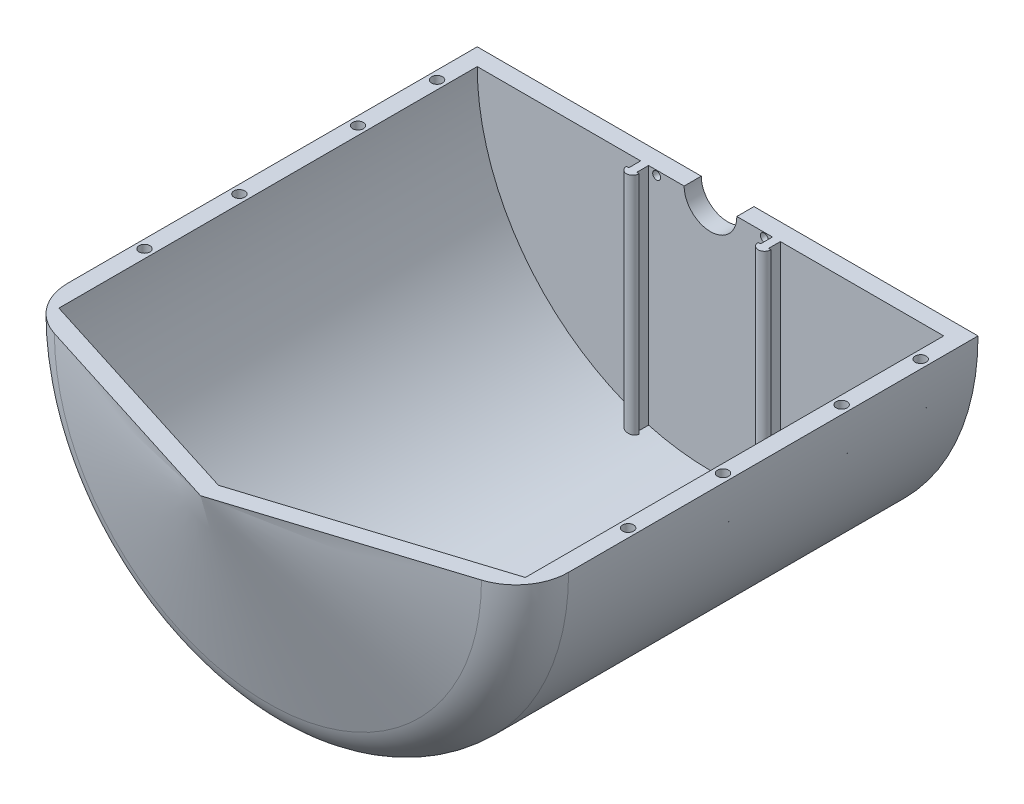
from build123d import *

# Parameters (mm, degrees)
REVOLVE1_ANGLE           = 180
BOSS_EXTRUDE8_REACH      = 185.507
BOSS_EXTRUDE8_END_RADIUS = 88.5
SKETCH7_R                = 10
SKETCH7_R_2              = 1.5
CUT_EXTRUDE1_DEPTH       = 10
SKETCH3_R                = 2.075
CUT_EXTRUDE3_DEPTH       = 15
FILLET1_R                = 20


with BuildPart() as part:
    # Sketch1 → Revolve1 (revolve)
    with BuildSketch(Plane(origin=(0, 0, 0), x_dir=(1, 0, 0), z_dir=(0, 1, 0))):
        Polygon((0, 75), (95, 75), (95, -95), (0, -125), align=None)
    revolve(axis=Axis((0, 0, 125), (0, 0, -1)), revolution_arc=REVOLVE1_ANGLE)

    # Sketch2 → Cut-Revolve3 (revolve, cut)
    with BuildSketch(Plane(origin=(0, 0, 0), x_dir=(1, 0, 0), z_dir=(0, 1, 0))):
        Polygon((0, 68.5), (0, -118.183600921), (88.5, -90.2362325), (88.5, 68.5), align=None)
    revolve(axis=Axis((0, 0, -68.5), (0, 0, 1)), mode=Mode.SUBTRACT)

    # Boss-Extrude8: up to this cylinder (the profile starts inside it)
    boss_extrude8_end = Plane(origin=(0, 0, -64.938407), z_dir=(0, 0, -1)) * Cylinder(BOSS_EXTRUDE8_END_RADIUS, 549.014, mode=Mode.PRIVATE)
    # Sketch5 → Boss-Extrude8 (add, up to the surface)
    with BuildSketch(Plane(origin=(0, 0, 0), x_dir=(1, 0, 0), z_dir=(0, 1, 0)), mode=Mode.PRIVATE) as boss_extrude8_sk1:
        with BuildLine():
            Line((23.5, 64), (23.5, 68.5))
            Line((23.5, 68.5), (26.5, 68.5))
            Line((26.5, 68.5), (26.5, 64))
            Line((26.5, 64), (27.4, 64))
            ThreePointArc((27.4, 64), (25, 61.6), (22.6, 64))
            Line((22.6, 64), (23.5, 64))
        make_face()
    boss_extrude8_tool1 = extrude(boss_extrude8_sk1.sketch, amount=-BOSS_EXTRUDE8_REACH, mode=Mode.PRIVATE) & boss_extrude8_end
    add(boss_extrude8_tool1.solids().sort_by_distance((25, 0, -64.938407))[0])
    # Sketch5 → Boss-Extrude8 (add, up to the surface)
    with BuildSketch(Plane(origin=(0, 0, 0), x_dir=(1, 0, 0), z_dir=(0, 1, 0)), mode=Mode.PRIVATE) as boss_extrude8_sk2:
        with BuildLine():
            Line((-27.4, 64), (-26.5, 64))
            Line((-26.5, 64), (-26.5, 68.5))
            Line((-26.5, 68.5), (-23.5, 68.5))
            Line((-23.5, 68.5), (-23.5, 64))
            Line((-23.5, 64), (-22.6, 64))
            ThreePointArc((-22.6, 64), (-25, 61.6), (-27.4, 64))
        make_face()
    boss_extrude8_tool2 = extrude(boss_extrude8_sk2.sketch, amount=-BOSS_EXTRUDE8_REACH, mode=Mode.PRIVATE) & boss_extrude8_end
    add(boss_extrude8_tool2.solids().sort_by_distance((-25, 0, -64.938407))[0])

    # Sketch7 → Cut-Extrude1 (cut)
    with BuildSketch(Plane.XY.offset(-68.5)):
        Circle(SKETCH7_R)
        with Locations((20.425168298, -1.75)):
            Circle(SKETCH7_R_2)
        with Locations(Location((-20.425168298, -1.75, 0), (0, 0, 180))):
            Circle(SKETCH7_R_2)
    extrude(amount=-CUT_EXTRUDE1_DEPTH, mode=Mode.SUBTRACT)

    # Sketch3 → Cut-Extrude3 (cut)
    with BuildSketch(Plane(origin=(0, 0, 0), x_dir=(1, 0, 0), z_dir=(0, 1, 0))):
        with Locations(Location((-91.75, 56.5, 0), (0, 0, 180))):
            Circle(SKETCH3_R)
        with Locations(Location((-91.75, 26.5, 0), (0, 0, 180))):
            Circle(SKETCH3_R)
        with Locations(Location((-91.75, -18.5, 0), (0, 0, 180))):
            Circle(SKETCH3_R)
        with Locations(Location((-91.75, -54.5, 0), (0, 0, 180))):
            Circle(SKETCH3_R)
        with Locations(Location((91.75, -54.5, 0), (0, 0, 7.270772685))):
            Circle(SKETCH3_R)
        with Locations(Location((91.75, -18.5, 0), (0, 0, 7.270772685))):
            Circle(SKETCH3_R)
        with Locations(Location((91.75, 26.5, 0), (0, 0, 7.270772685))):
            Circle(SKETCH3_R)
        with Locations(Location((91.75, 56.5, 0), (0, 0, 7.270772685))):
            Circle(SKETCH3_R)
    extrude(amount=-CUT_EXTRUDE3_DEPTH, mode=Mode.SUBTRACT)

    # Fillet1
    fillet1_edges = [part.edges().sort_by_distance(p)[0] for p in [
        (0, -95, 95),
    ]]
    fillet(fillet1_edges, radius=FILLET1_R)


solid = part.part
